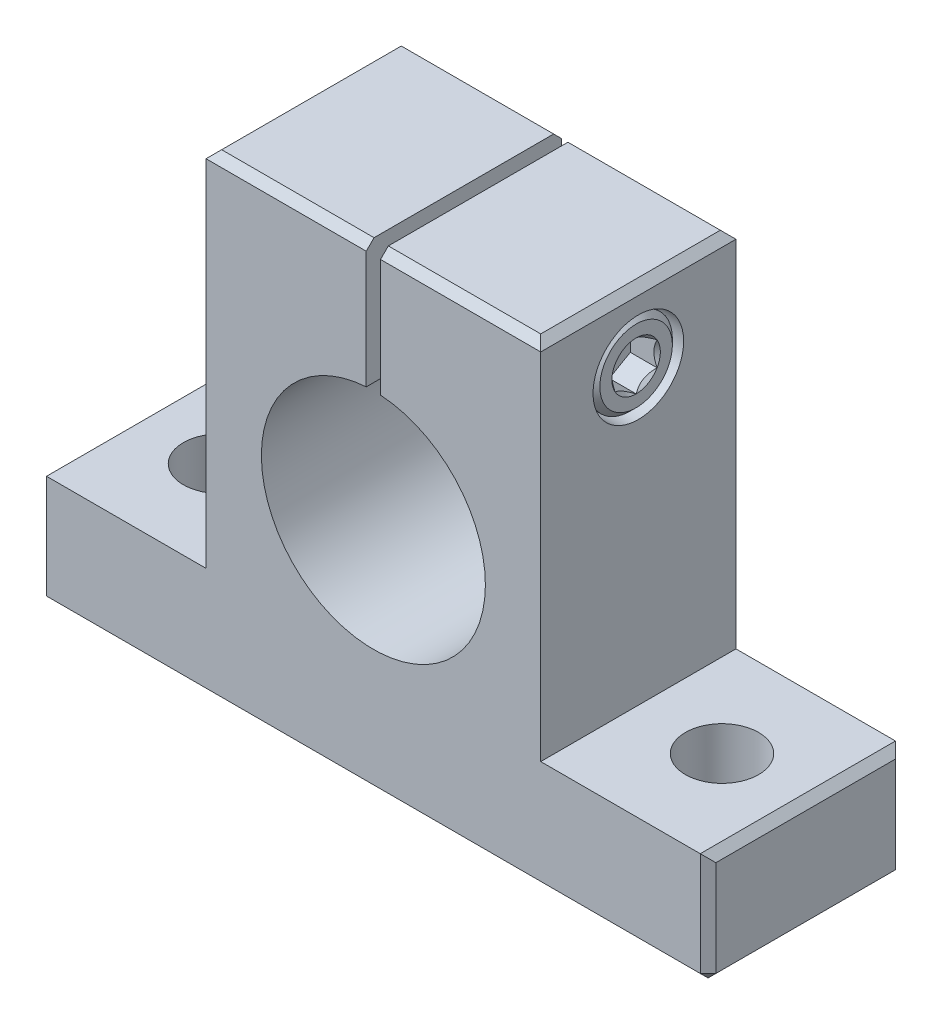
from build123d import *

# Parameters (mm, degrees)
BOSS_EXTRUDE1_DEPTH = 11.1125
CHAMFER1_SIZE       = 0.889
SKETCH2_R           = 4.1656
CUT_EXTRUDE1_DEPTH  = 67.995509411
CUT_EXTRUDE4_DEPTH  = 3.048


with BuildPart() as part:
    # Sketch1 → Boss-Extrude1 (new, symmetric)
    with BuildSketch(Plane.XY):
        with BuildLine():
            Line((-38.1, 0), (38.1, 0))
            Line((38.1, 0), (38.1, 12.7))
            Line((38.1, 12.7), (19.05, 12.7))
            Line((19.05, 12.7), (19.05, 53.975))
            Line((19.05, 53.975), (0.8128, 53.975))
            Line((0.8128, 53.975), (0.8128, 39.712367654))
            ThreePointArc((0.8128, 39.712367654), (0, 14.2367), (-0.8128, 39.712367654))
            Line((-0.8128, 39.712367654), (-0.8128, 53.975))
            Line((-0.8128, 53.975), (-19.05, 53.975))
            Line((-19.05, 53.975), (-19.05, 12.7))
            Line((-19.05, 12.7), (-38.1, 12.7))
            Line((-38.1, 12.7), (-38.1, 0))
        make_face()
    extrude(amount=BOSS_EXTRUDE1_DEPTH, both=True)

    # Chamfer1
    chamfer1_edges = [part.edges().sort_by_distance(p)[0] for p in [
        (38.1, 6.35, 11.1125),
        (-9.9314, 53.975, -11.1125),
        (9.9314, 53.975, -11.1125),
        (38.1, 6.35, -11.1125),
        (0, 0, -11.1125),
        (-38.1, 6.35, -11.1125),
        (9.9314, 53.975, 11.1125),
        (-38.1, 12.7, 0),
        (-19.05, 53.975, 0),
        (19.05, 53.975, 0),
        (38.1, 12.7, 0),
        (38.1, 0, 0),
        (-38.1, 0, 0),
        (-9.9314, 53.975, 11.1125),
        (-38.1, 6.35, 11.1125),
        (0, 0, 11.1125),
    ]]
    chamfer(chamfer1_edges, length=CHAMFER1_SIZE)

    # Sketch2 → Cut-Extrude1 (cut, through all)
    with BuildSketch(Plane(origin=(0, 0, 0), x_dir=(1, 0, 0), z_dir=(0, 1, 0))):
        with Locations(Location((-28.575, 0, 0), (0, 0, 90))):
            Circle(SKETCH2_R)
        with Locations(Location((28.575, 0, 0), (0, 0, 90))):
            Circle(SKETCH2_R)
    extrude(amount=CUT_EXTRUDE1_DEPTH, mode=Mode.SUBTRACT)

    # Sketch3 → Cut-Revolve1 (revolve, cut)
    with BuildSketch(Plane.XY, mode=Mode.PRIVATE) as cut_revolve1_sk:
        Polygon((-19.05, 46.0248), (-19.05, 49.1998), (-1.27, 49.1998), (-1.27, 49.2887), (12.446, 49.2887), (12.446, 51.181), (19.05, 51.181), (19.05, 46.0248), align=None)
    revolve(cut_revolve1_sk.sketch.rotate(Axis((19.05, 46.0248, 0), (-1, 0, 0)), 90), axis=Axis((19.05, 46.0248, 0), (-1, 0, 0)), mode=Mode.SUBTRACT)


with BuildPart() as body_2:
    # Sketch4 → Revolve1 (revolve)
    with BuildSketch(Plane.XY):
        Polygon((-12.954, 46.0248), (-12.954, 49.1998), (12.446, 49.1998), (12.446, 50.6603), (12.573, 50.7873), (18.161, 50.7873), (18.796, 50.1523), (18.796, 46.0248), align=None)
    revolve(axis=Axis((18.796, 46.0248, 0), (-1, 0, 0)))

    # Sketch5 → Cut-Extrude4 (cut)
    with BuildSketch(Plane(origin=(18.796, 0, 0), x_dir=(0, 0, -1), z_dir=(1, 0, 0))):
        Polygon((0, 48.781763005), (-2.3876, 47.403281503), (-2.3876, 44.646318497), (0, 43.267836995), (2.3876, 44.646318497), (2.3876, 47.403281503), align=None)
    extrude(amount=-CUT_EXTRUDE4_DEPTH, mode=Mode.SUBTRACT)

    # Cut-Extrude5 cone 1 section (through the dimple's axis) → Cut-Extrude5 (revolve, cut)
    with BuildSketch(Plane(origin=(18.796, 46.0248, 0), x_dir=(0, 0, -1), z_dir=(0, 1, 0))):
        Polygon((0, 0), (2.756963005, 0), (0, 2.756963005), align=None)
    revolve(axis=Axis((18.796, 46.0248, 0), (-1, 0, 0)), mode=Mode.SUBTRACT)


solid = Compound([part.part, body_2.part])
